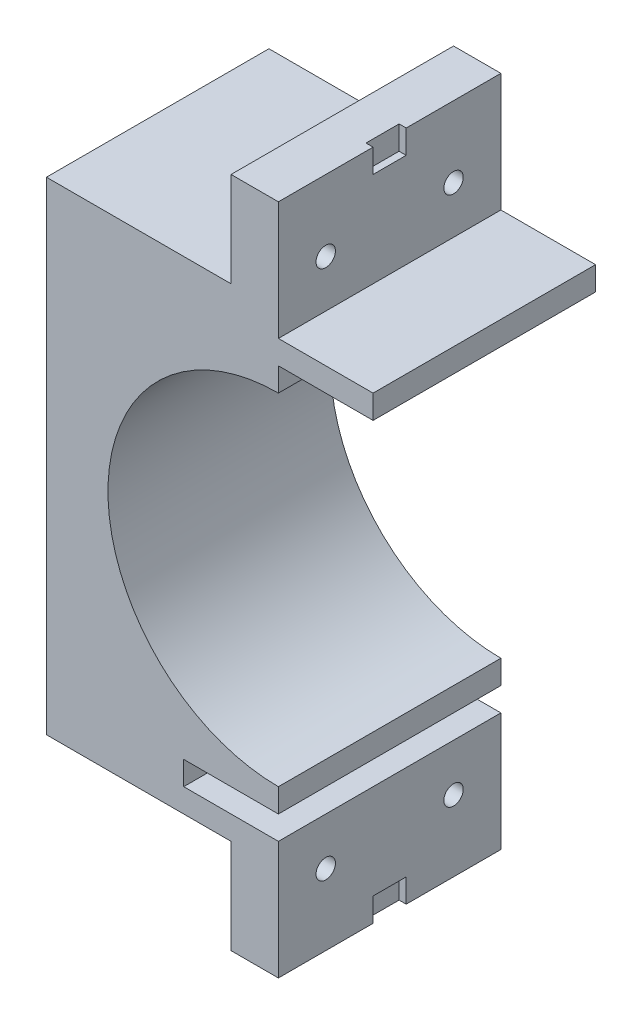
from build123d import *

# Parameters (mm, degrees)
EXTRUDE_1_DEPTH     = 47
SKETCH_2_W          = 47
SKETCH_2_H          = 20
EXTRUDE_2_DEPTH     = 10
SKETCH_3_W          = 20
SKETCH_3_H          = 5
EXTRUDE_3_DEPTH     = 47
SKETCH_4_W          = 20
SKETCH_4_H          = 5
CUT_EXTRUDE_1_DEPTH = 99.239503256
SKETCH_5_R          = 2.05
CUT_EXTRUDE_2_DEPTH = 10
SKETCH_6_R          = 2.05
CUT_EXTRUDE_3_DEPTH = 10
SKETCH_7_W          = 1.5
SKETCH_7_H          = 7
CUT_EXTRUDE_4_DEPTH = 5
SKETCH_8_W          = 1.5
SKETCH_8_H          = 7
CUT_EXTRUDE_5_DEPTH = 5
SKETCH_9_W          = 1.8
SKETCH_9_H          = 7
CUT_EXTRUDE_6_DEPTH = 6


with BuildPart() as part:
    # 草图1 → 凸台-拉伸1 (new body)
    with BuildSketch(Plane.XY):
        with BuildLine():
            Line((0, 36), (0, 51))
            Line((0, 51), (-49, 51))
            Line((-49, 51), (-49, -51))
            Line((-49, -51), (0, -51))
            Line((0, -51), (0, -36))
            ThreePointArc((0, -36), (-36, 0), (0, 36))
        make_face()
    extrude(amount=EXTRUDE_1_DEPTH)

    # 草图2 → 凸台-拉伸2 (add)
    with BuildSketch(Plane(origin=(-10, 0, 0), x_dir=(0, 0, -1), z_dir=(1, 0, 0))):
        with Locations((-23.5, -61)):
            Rectangle(SKETCH_2_W, SKETCH_2_H)
        with Locations((-23.5, 61)):
            Rectangle(SKETCH_2_W, SKETCH_2_H)
    extrude(amount=EXTRUDE_2_DEPTH)

    # 草图3 → 凸台-拉伸3 (add, through all)
    with BuildSketch(Plane.XY.offset(47)):
        with Locations((10, 43.5)):
            Rectangle(SKETCH_3_W, SKETCH_3_H)
    extrude(amount=-EXTRUDE_3_DEPTH)

    # 草图4 → 切除-拉伸1 (cut, through all)
    with BuildSketch(Plane.XY.offset(47)):
        with Locations((-10, -43.5)):
            Rectangle(SKETCH_4_W, SKETCH_4_H)
    extrude(amount=-CUT_EXTRUDE_1_DEPTH, mode=Mode.SUBTRACT)

    # 草图5 → 切除-拉伸2 (cut)
    with BuildSketch(Plane.ZY.offset(10)):
        with Locations((10, -56)):
            Circle(SKETCH_5_R)
        with Locations((37, -56)):
            Circle(SKETCH_5_R)
    extrude(amount=-CUT_EXTRUDE_2_DEPTH, mode=Mode.SUBTRACT)

    # 草图6 → 切除-拉伸3 (cut)
    with BuildSketch(Plane.ZY.offset(10)):
        with Locations((10, 56)):
            Circle(SKETCH_6_R)
        with Locations((37, 56)):
            Circle(SKETCH_6_R)
    extrude(amount=-CUT_EXTRUDE_3_DEPTH, mode=Mode.SUBTRACT)

    # 草图7 → 切除-拉伸4 (cut)
    with BuildSketch(Plane.XZ.offset(71)):
        with Locations((-0.75, 23.5)):
            Rectangle(SKETCH_7_W, SKETCH_7_H)
    extrude(amount=-CUT_EXTRUDE_4_DEPTH, mode=Mode.SUBTRACT)

    # 草图8 → 切除-拉伸5 (cut)
    with BuildSketch(Plane(origin=(0, 71, 0), x_dir=(1, 0, 0), z_dir=(0, 1, 0))):
        with Locations((-0.75, -23.5)):
            Rectangle(SKETCH_8_W, SKETCH_8_H)
    extrude(amount=-CUT_EXTRUDE_5_DEPTH, mode=Mode.SUBTRACT)

    # 草图9 → 切除-拉伸6 (cut)
    with BuildSketch(Plane.ZY.offset(49)):
        with Locations((0.9, 0)):
            Rectangle(SKETCH_9_W, SKETCH_9_H)
    extrude(amount=-CUT_EXTRUDE_6_DEPTH, mode=Mode.SUBTRACT)


solid = part.part
